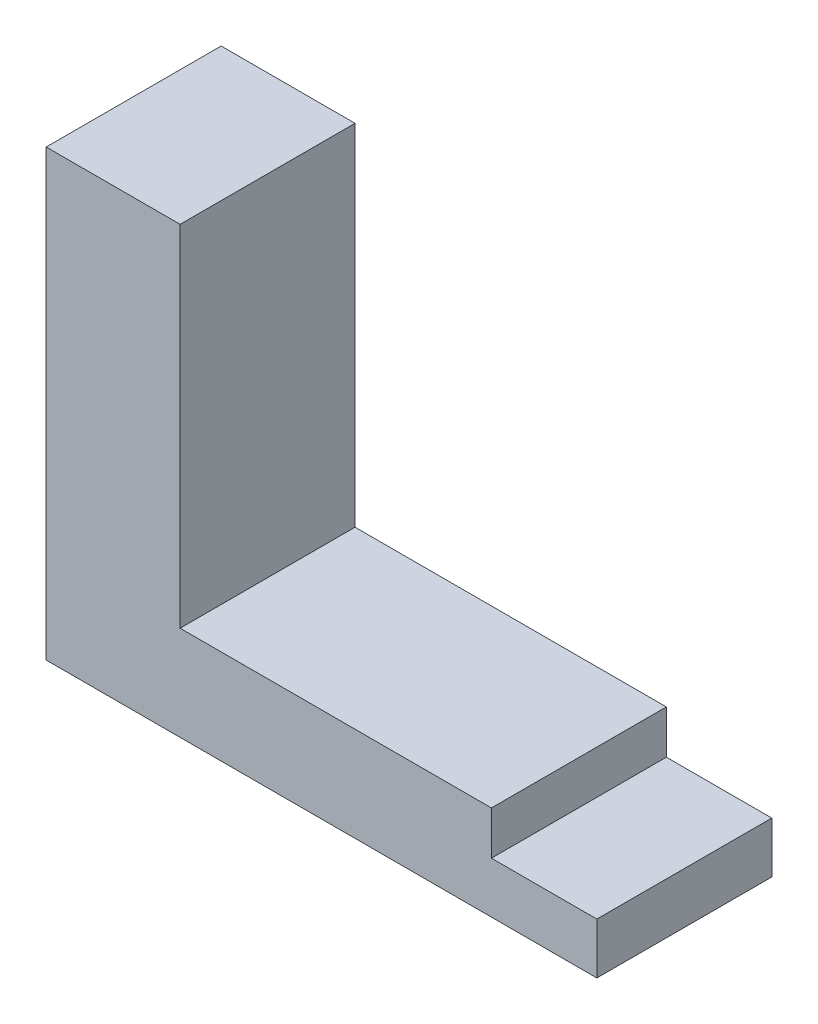
from build123d import *

# Parameters (mm, degrees)
BOSS_EXTRU_1_DEPTH = 20


with BuildPart() as part:
    # Esquisse1 → Boss.-Extru.1 (new body)
    with BuildSketch(Plane.XY):
        Polygon((0, 0), (0, 50.802993514), (15.307869985, 50.802993514), (15.307869985, 10.811183177), (50.898667701, 10.811183177), (50.898667701, 5.836125432), (62.953615315, 5.836125432), (62.953615315, 0), align=None)
    extrude(amount=BOSS_EXTRU_1_DEPTH)


solid = part.part
